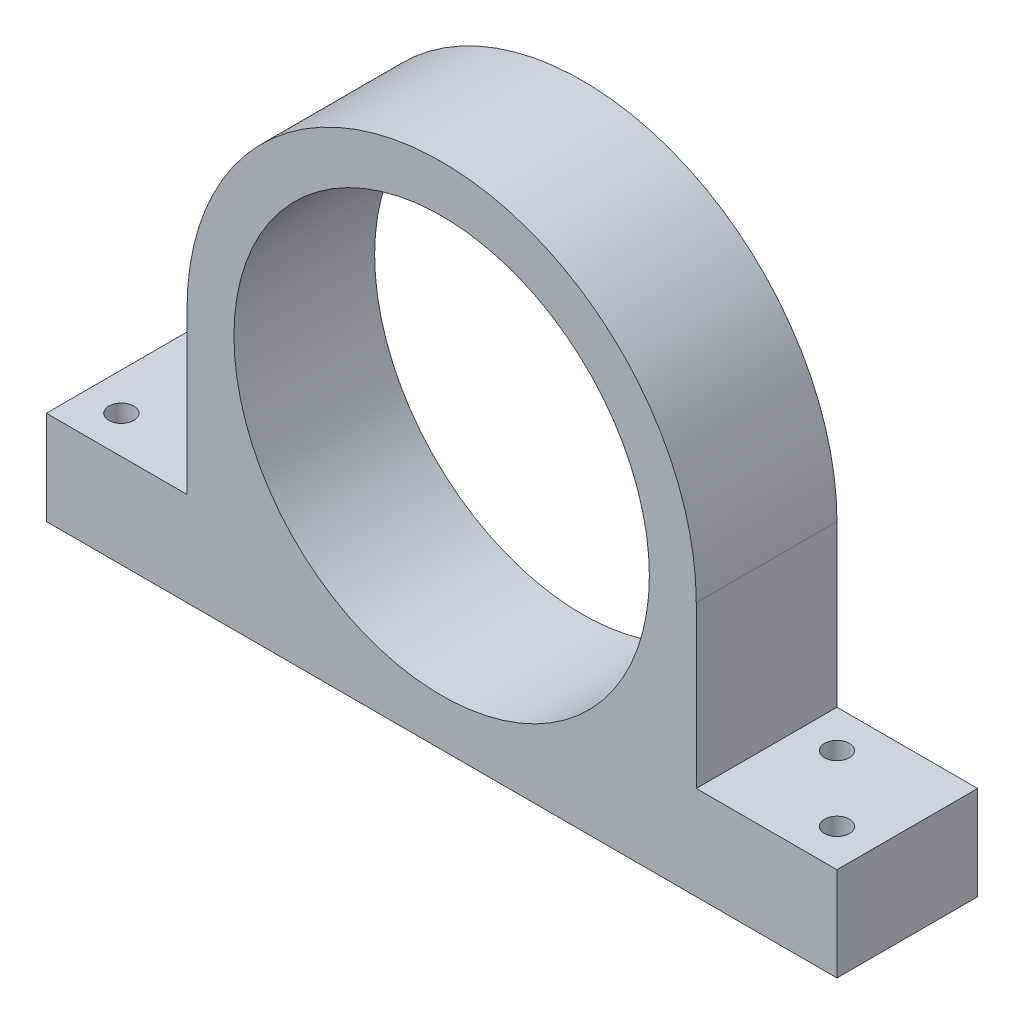
from build123d import *

# Parameters (mm, degrees)
SKETCH2_R                 = 22.50059
BOSS_EXTRUDE1_DEPTH       = 7.62
TAP_DRILL_FOR_6_32_TAP1_D = 2.7051


with BuildPart() as part:
    # Sketch2 → Boss-Extrude1 (new, symmetric)
    with BuildSketch(Plane.XY):
        with BuildLine():
            Line((-27.58059, 27.58059), (-27.58059, 10.16))
            Line((-27.58059, 10.16), (-42.82059, 10.16))
            Line((-42.82059, 10.16), (-42.82059, 0))
            Line((-42.82059, 0), (42.82059, 0))
            Line((42.82059, 0), (42.82059, 10.16))
            Line((42.82059, 10.16), (27.58059, 10.16))
            Line((27.58059, 10.16), (27.58059, 27.58059))
            ThreePointArc((27.58059, 27.58059), (0, 55.16118), (-27.58059, 27.58059))
        make_face()
        with Locations(Location((0, 27.58059, 0), (0, 0, 180))):
            Circle(SKETCH2_R, mode=Mode.SUBTRACT)
    extrude(amount=BOSS_EXTRUDE1_DEPTH, both=True)

    # Tap Drill for #6-32 Tap1 (through all)
    with Locations(Plane(origin=(0, 10.16, 0), x_dir=(1, 0, 0), z_dir=(0, 1, 0))):
        with Locations((-38.75659, -3.556), (-31.64459, 3.556), (31.64459, 3.556), (38.75659, -3.556)):
            Hole(TAP_DRILL_FOR_6_32_TAP1_D / 2)


solid = part.part
